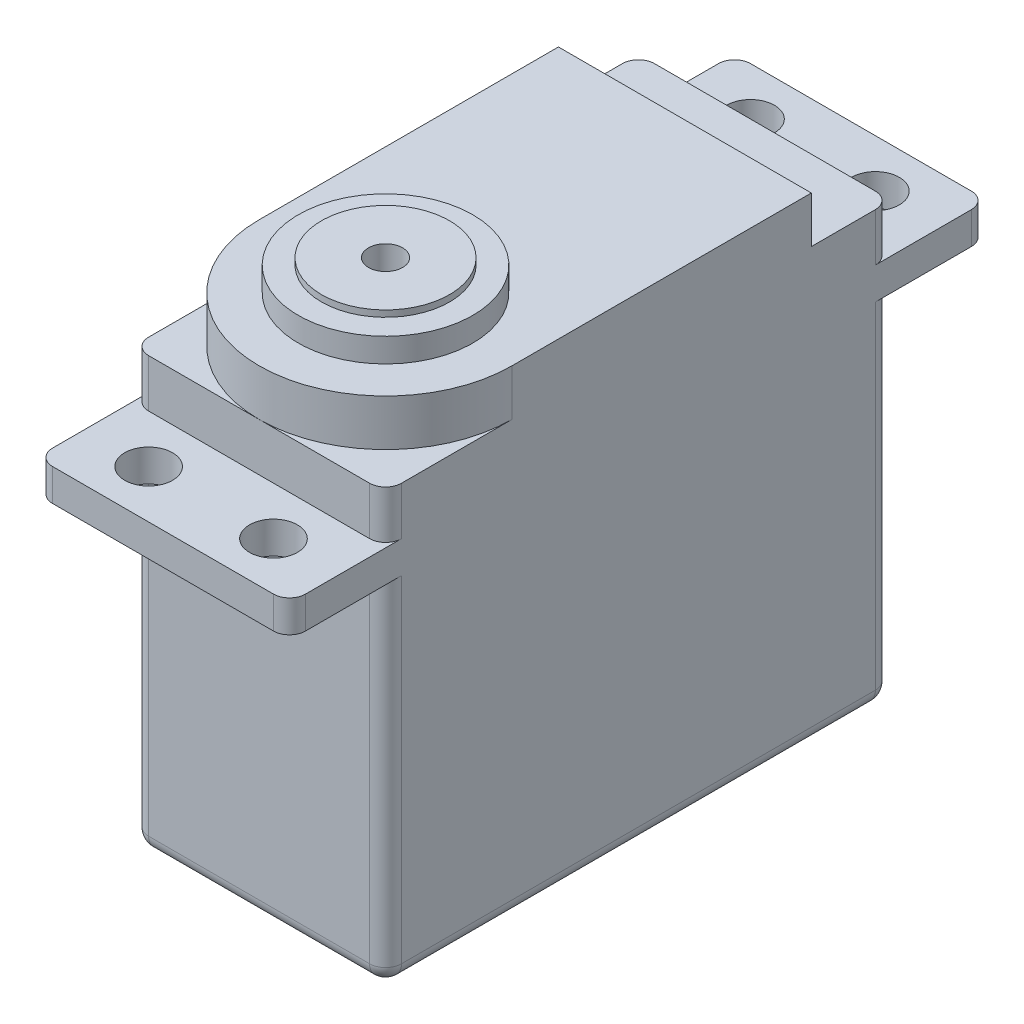
from build123d import *

# Parameters (mm, degrees)
SKETCH1_W                 = 40.132
SKETCH1_H                 = 34.29
BOSS_EXTRUDE1_DEPTH       = 20.066
BOSS_EXTRUDE2_DEPTH       = 3.683
SKETCH3_R                 = 6.9215
BOSS_EXTRUDE3_DEPTH       = 1.905
SKETCH4_R                 = 5.08
BOSS_EXTRUDE4_DEPTH       = 0.508
F_6_32_TAPPED_HOLE1_D     = 2.7051
F_6_32_TAPPED_HOLE1_DEPTH = 11.176
F_6_32_TAPPED_HOLE1_TIP   = 0.81269403
SKETCH8_W                 = 20.066
SKETCH8_H                 = 2.54
BOSS_EXTRUDE5_DEPTH       = 7.62
SKETCH9_W                 = 20.066
SKETCH9_H                 = 2.54
BOSS_EXTRUDE6_DEPTH       = 7.62
F_6_CLEARANCE_HOLE1_D     = 3.7973
F_6_CLEARANCE_HOLE1_DEPTH = 3.81
F_6_CLEARANCE_HOLE1_TIP   = 1.140824014
FILLET1_R                 = 1.27


with BuildPart() as part:
    # Sketch1 → Boss-Extrude1 (new body)
    with BuildSketch(Plane(origin=(0, 0, 0), x_dir=(0, 0, -1), z_dir=(1, 0, 0))):
        with Locations((20.066, 17.145)):
            Rectangle(SKETCH1_W, SKETCH1_H)
    extrude(amount=BOSS_EXTRUDE1_DEPTH)

    # Sketch2 → Boss-Extrude2 (add)
    with BuildSketch(Plane(origin=(0, 34.29, 0), x_dir=(1, 0, 0), z_dir=(0, 1, 0))):
        with BuildLine():
            Line((0, 33.782), (20.066, 33.782))
            Line((20.066, 33.782), (20.066, 10.033))
            ThreePointArc((20.066, 10.033), (10.033, 0), (0, 10.033))
            Line((0, 10.033), (0, 33.782))
        make_face()
    extrude(amount=BOSS_EXTRUDE2_DEPTH)

    # Sketch3 → Boss-Extrude3 (add)
    with BuildSketch(Plane(origin=(0, 37.973, 0), x_dir=(1, 0, 0), z_dir=(0, 1, 0))):
        with Locations(Location((10.033, 10.033, 0), (0, 0, 90))):
            Circle(SKETCH3_R)
    extrude(amount=BOSS_EXTRUDE3_DEPTH)

    # Sketch4 → Boss-Extrude4 (add)
    with BuildSketch(Plane(origin=(0, 39.878, 0), x_dir=(1, 0, 0), z_dir=(0, 1, 0))):
        with Locations(Location((10.033, 10.033, 0), (0, 0, 270))):
            Circle(SKETCH4_R)
    extrude(amount=BOSS_EXTRUDE4_DEPTH)

    # #6-32 Tapped Hole1
    with Locations(Plane(origin=(0, 40.386, 0), x_dir=(1, 0, 0), z_dir=(0, 1, 0))):
        with Locations((10.033, 10.033)):
            Hole(F_6_32_TAPPED_HOLE1_D / 2, depth=F_6_32_TAPPED_HOLE1_DEPTH)
            with Locations((0, 0, -(F_6_32_TAPPED_HOLE1_DEPTH + F_6_32_TAPPED_HOLE1_TIP / 2))):  # 118° drill point
                Cone(0, F_6_32_TAPPED_HOLE1_D / 2, F_6_32_TAPPED_HOLE1_TIP, mode=Mode.SUBTRACT)

    # Sketch8 → Boss-Extrude5 (add)
    with BuildSketch(Plane.XY):
        with Locations((10.033, 29.21)):
            Rectangle(SKETCH8_W, SKETCH8_H)
    extrude(amount=BOSS_EXTRUDE5_DEPTH)

    # Sketch9 → Boss-Extrude6 (add)
    with BuildSketch(Plane(origin=(0, 0, -40.132), x_dir=(-1, 0, 0), z_dir=(0, 0, -1))):
        with Locations((-10.033, 29.21)):
            Rectangle(SKETCH9_W, SKETCH9_H)
    extrude(amount=BOSS_EXTRUDE6_DEPTH)

    # #6 Clearance Hole1
    with Locations(Plane(origin=(0, 30.48, 0), x_dir=(1, 0, 0), z_dir=(0, 1, 0))):
        with Locations((14.986, -3.81), (5.08, -3.81), (5.08, 43.942), (14.986, 43.942)):
            Hole(F_6_CLEARANCE_HOLE1_D / 2, depth=F_6_CLEARANCE_HOLE1_DEPTH)
            with Locations((0, 0, -(F_6_CLEARANCE_HOLE1_DEPTH + F_6_CLEARANCE_HOLE1_TIP / 2))):  # 118° drill point
                Cone(0, F_6_CLEARANCE_HOLE1_D / 2, F_6_CLEARANCE_HOLE1_TIP, mode=Mode.SUBTRACT)

    # Fillet1
    fillet1_edges = [part.edges().sort_by_distance(p)[0] for p in [
        (10.033, 0, 0),
        (20.066, 0, -20.066),
        (10.033, 0, -40.132),
        (0, 0, -20.066),
        (0, 32.385, -40.132),
        (0, 13.97, -40.132),
        (20.066, 13.97, -40.132),
        (20.066, 32.385, -40.132),
        (20.066, 32.385, 0),
        (20.066, 13.97, 0),
        (0, 32.385, 0),
        (0, 13.97, 0),
        (20.066, 29.21, -47.752),
        (0, 29.21, -47.752),
        (20.066, 29.21, 7.62),
        (0, 29.21, 7.62),
    ]]
    fillet(fillet1_edges, radius=FILLET1_R)


solid = part.part
